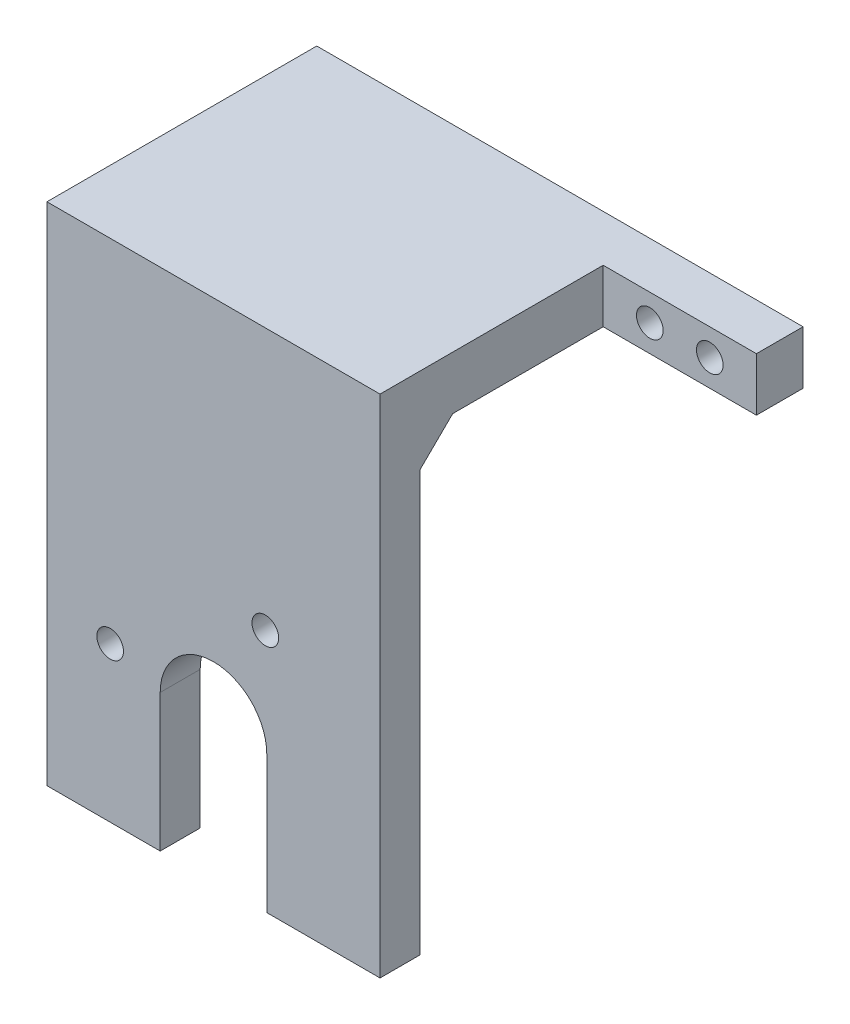
from build123d import *

# Parameters (mm, degrees)
SKETCH1_W           = 50
SKETCH1_H           = 18
BOSS_EXTRUDE1_DEPTH = 7
SKETCH2_W           = 50
SKETCH2_H           = 8
BOSS_EXTRUDE2_DEPTH = 33.5
SKETCH3_W           = 7
SKETCH3_H           = 8
BOSS_EXTRUDE3_DEPTH = 23
SKETCH4_W           = 7
SKETCH4_H           = 8
BOSS_EXTRUDE4_DEPTH = 14
SKETCH5_W           = 50
SKETCH5_H           = 10
CUT_EXTRUDE1_DEPTH  = 14
SKETCH6_R           = 2
CUT_EXTRUDE2_DEPTH  = 14
SKETCH7_W           = 50
SKETCH7_H           = 6
BOSS_EXTRUDE5_DEPTH = 67.91
CUT_EXTRUDE3_DEPTH  = 35
SKETCH9_R           = 2
CUT_EXTRUDE5_DEPTH  = 35
BOSS_EXTRUDE8_DEPTH = 50
SKETCH13_W          = 14
SKETCH13_H          = 8
CUT_EXTRUDE6_DEPTH  = 10


with BuildPart() as part:
    # Sketch1 → Boss-Extrude1 (new body)
    with BuildSketch(Plane.XY):
        with Locations((-12.394067797, 1.955508475)):
            Rectangle(SKETCH1_W, SKETCH1_H)
    extrude(amount=BOSS_EXTRUDE1_DEPTH)

    # Sketch2 → Boss-Extrude2 (add)
    with BuildSketch(Plane.XY.offset(7)):
        with Locations((-12.394067797, 6.955508475)):
            Rectangle(SKETCH2_W, SKETCH2_H)
    extrude(amount=BOSS_EXTRUDE2_DEPTH)

    # Sketch3 → Boss-Extrude3 (add)
    with BuildSketch(Plane(origin=(12.605932203, 0, 0), x_dir=(0, 0, -1), z_dir=(1, 0, 0))):
        with Locations((-3.5, 6.955508475)):
            Rectangle(SKETCH3_W, SKETCH3_H)
    extrude(amount=BOSS_EXTRUDE3_DEPTH)

    # Sketch4 → Boss-Extrude4 (add)
    with BuildSketch(Plane.ZY.offset(37.394067797)):
        with Locations((3.5, 6.955508475)):
            Rectangle(SKETCH4_W, SKETCH4_H)
    extrude(amount=BOSS_EXTRUDE4_DEPTH)

    # Sketch5 → Cut-Extrude1 (cut)
    with BuildSketch(Plane.XY.offset(7)):
        with Locations((-12.394067797, -2.044491525)):
            Rectangle(SKETCH5_W, SKETCH5_H)
    extrude(amount=-CUT_EXTRUDE1_DEPTH, mode=Mode.SUBTRACT)

    # Sketch6 → Cut-Extrude2 (cut)
    with BuildSketch(Plane.XY.offset(7)):
        with Locations((19.605932203, 6.955508475)):
            Circle(SKETCH6_R)
        with Locations((28.605932203, 6.955508475)):
            Circle(SKETCH6_R)
    extrude(amount=-CUT_EXTRUDE2_DEPTH, mode=Mode.SUBTRACT)

    # Sketch7 → Boss-Extrude5 (add)
    with BuildSketch(Plane.XZ.offset(-2.955508475)):
        with Locations((-12.394067797, 37.5)):
            Rectangle(SKETCH7_W, SKETCH7_H)
    extrude(amount=BOSS_EXTRUDE5_DEPTH)

    # Sketch8 → Cut-Extrude3 (cut)
    with BuildSketch(Plane.XY.offset(40.5)):
        with BuildLine():
            Line((-4.394067797, -44.33115583), (-4.394067797, -64.954491525))
            ThreePointArc((-4.394067797, -64.954491525), (-12.394067797, -72.954491525), (-20.394067797, -64.954491525))
            Line((-20.394067797, -64.954491525), (-20.394067797, -44.33115583))
            ThreePointArc((-20.394067797, -44.33115583), (-12.394067797, -36.33115583), (-4.394067797, -44.33115583))
        make_face()
    extrude(amount=-CUT_EXTRUDE3_DEPTH, mode=Mode.SUBTRACT)

    # Sketch9 → Cut-Extrude5 (cut)
    with BuildSketch(Plane(origin=(0, 0, 34.5), x_dir=(-1, 0, 0), z_dir=(0, 0, -1))):
        with Locations((27.901028765, -41.756933891)):
            Circle(SKETCH9_R)
        with Locations((4.616687569, -28.370715783)):
            Circle(SKETCH9_R)
    extrude(amount=-CUT_EXTRUDE5_DEPTH, mode=Mode.SUBTRACT)

    # Sketch12 → Boss-Extrude8 (add)
    with BuildSketch(Plane.ZY.offset(37.394067797)):
        Polygon((34.5, -1.873493289), (29.5872605, 2.955508475), (34.5, 2.955508475), align=None)
    extrude(amount=-BOSS_EXTRUDE8_DEPTH)

    # Sketch13 → Cut-Extrude6 (cut)
    with BuildSketch(Plane.XY.offset(7)):
        with Locations((-44.394067797, 6.955508475)):
            Rectangle(SKETCH13_W, SKETCH13_H)
    extrude(amount=-CUT_EXTRUDE6_DEPTH, mode=Mode.SUBTRACT)


solid = part.part
